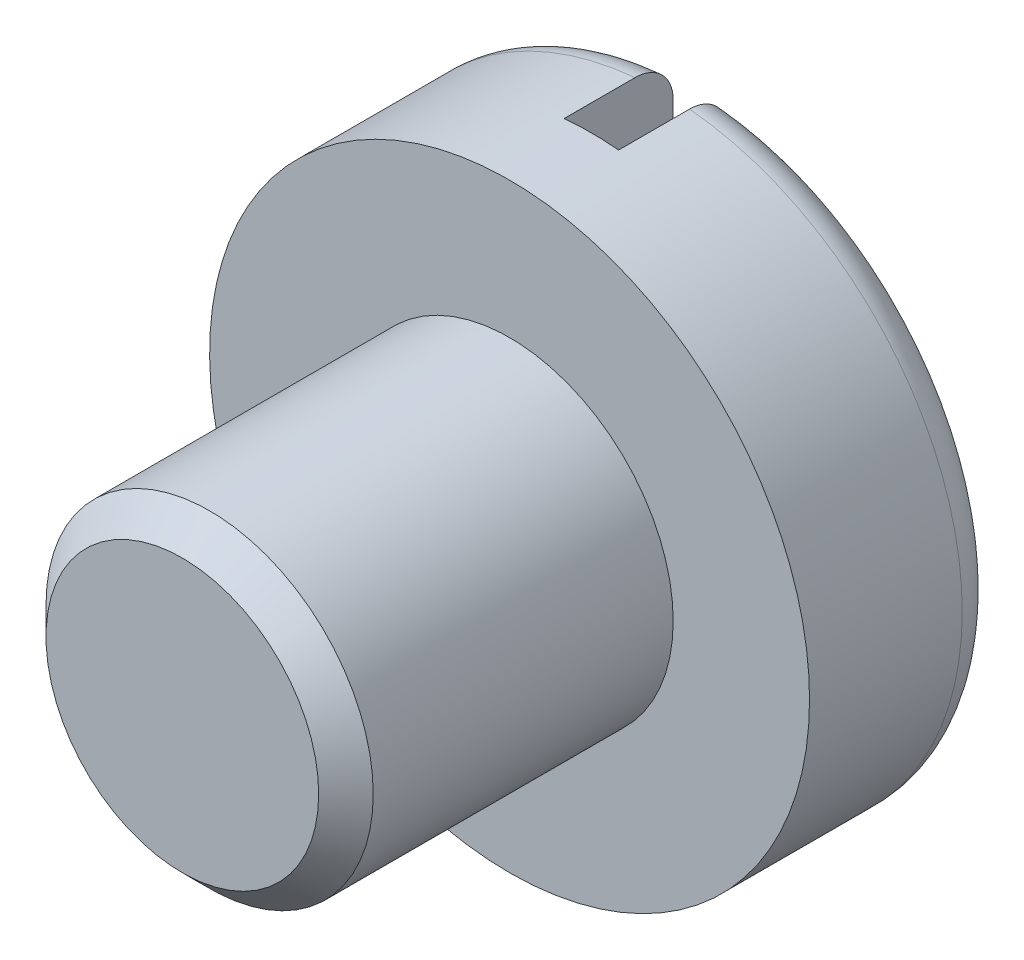
from build123d import *

# Parameters (mm, degrees)
ESQUISSE2_R             = 5.5
BOSS_EXTRU_1_DEPTH      = 3.5
ESQUISSE3_R             = 3
BOSS_EXTRU_2_DEPTH      = 6
CONG_2_R                = 0.7
CHANFREIN1_SIZE         = 0.5
ENL_V_MAT_EXTRU_1_DEPTH = 2


with BuildPart() as part:
    # Esquisse2 → Boss.-Extru.1 (new body)
    with BuildSketch(Plane.XY):
        Circle(ESQUISSE2_R)
    extrude(amount=BOSS_EXTRU_1_DEPTH)

    # Esquisse3 → Boss.-Extru.2 (add)
    with BuildSketch(Plane.XY.offset(3.5)):
        Circle(ESQUISSE3_R)
    extrude(amount=BOSS_EXTRU_2_DEPTH)

    # Congé2
    cong_2_edges = [part.edges().sort_by_distance(p)[0] for p in [
        (-5.5, 0, 0),
    ]]
    fillet(cong_2_edges, radius=CONG_2_R)

    # Chanfrein1
    chanfrein1_edges = [part.edges().sort_by_distance(p)[0] for p in [
        (-3, 0, 9.5),
    ]]
    chamfer(chanfrein1_edges, length=CHANFREIN1_SIZE)

    # Esquisse4 → Enlèv. mat.-Extru.1 (cut)
    with BuildSketch(Plane(origin=(0, 0, 0), x_dir=(-1, 0, 0), z_dir=(0, 0, -1))):
        with BuildLine():
            Line((-0.5, 5.477225575), (-0.5, -5.477225575))
            ThreePointArc((-0.5, -5.477225575), (0, -5.5), (0.5, -5.477225575))
            Line((0.5, -5.477225575), (0.5, 5.477225575))
            ThreePointArc((0.5, 5.477225575), (0, 5.5), (-0.5, 5.477225575))
        make_face()
    extrude(amount=-ENL_V_MAT_EXTRU_1_DEPTH, mode=Mode.SUBTRACT)


solid = part.part
